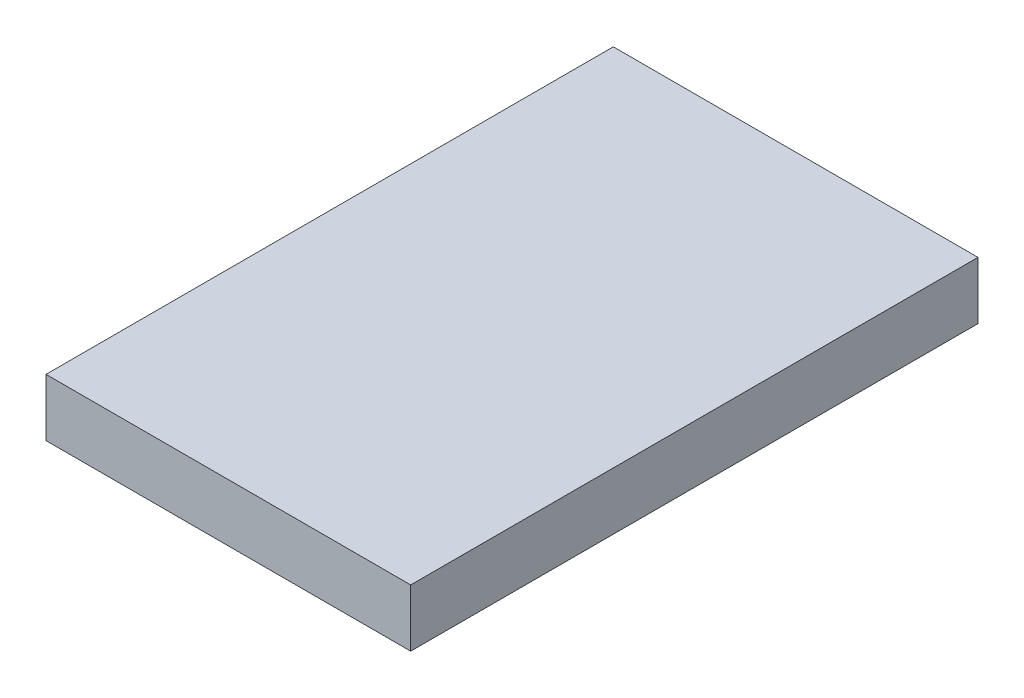
from build123d import *

# Parameters (mm, degrees)
SKETCH1_W           = 54
SKETCH1_H           = 84
BOSS_EXTRUDE1_DEPTH = 8.5


with BuildPart() as part:
    # Sketch1 → Boss-Extrude1 (new body)
    with BuildSketch(Plane(origin=(0, 0, 0), x_dir=(1, 0, 0), z_dir=(0, 1, 0))):
        with Locations((-27, 42)):
            Rectangle(SKETCH1_W, SKETCH1_H)
    extrude(amount=BOSS_EXTRUDE1_DEPTH)


solid = part.part
